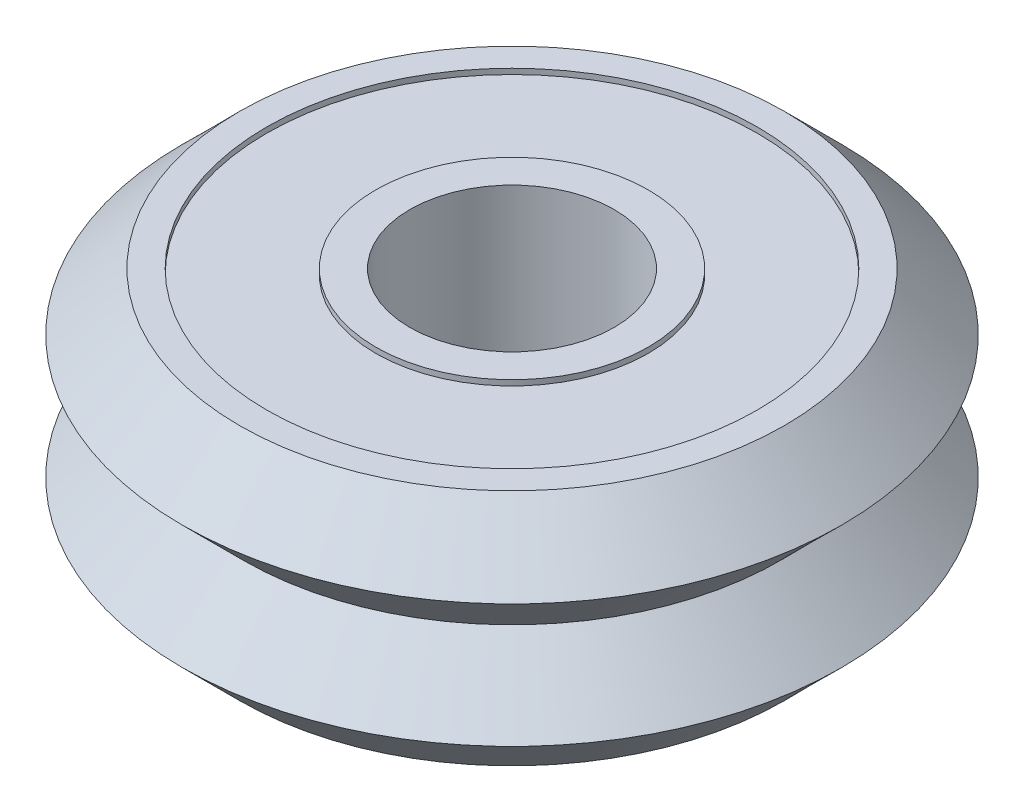
from build123d import *


with BuildPart() as part:
    # Sketch1 → Revolve1 (revolve)
    with BuildSketch(Plane(origin=(0, 0, 0), x_dir=(-1, 0, 0), z_dir=(0, 0, -1)), mode=Mode.PRIVATE) as revolve1_sk:
        Polygon((-11.43, 5.296), (-11.43, 5.55), (-12.69, 5.55), (-15.365, 2.875), (-12.49, 0), (-15.365, -2.875), (-12.69, -5.55), (-11.43, -5.55), (-11.43, -5.296), (-6.35, -5.296), (-6.35, -5.55), (-4.7625, -5.55), (-4.7625, 5.55), (-6.35, 5.55), (-6.35, 5.296), align=None)
    revolve(revolve1_sk.sketch.rotate(Axis((0, -5.55, 0), (0, 1, 0)), 270), axis=Axis((0, -5.55, 0), (0, 1, 0)))


solid = part.part
